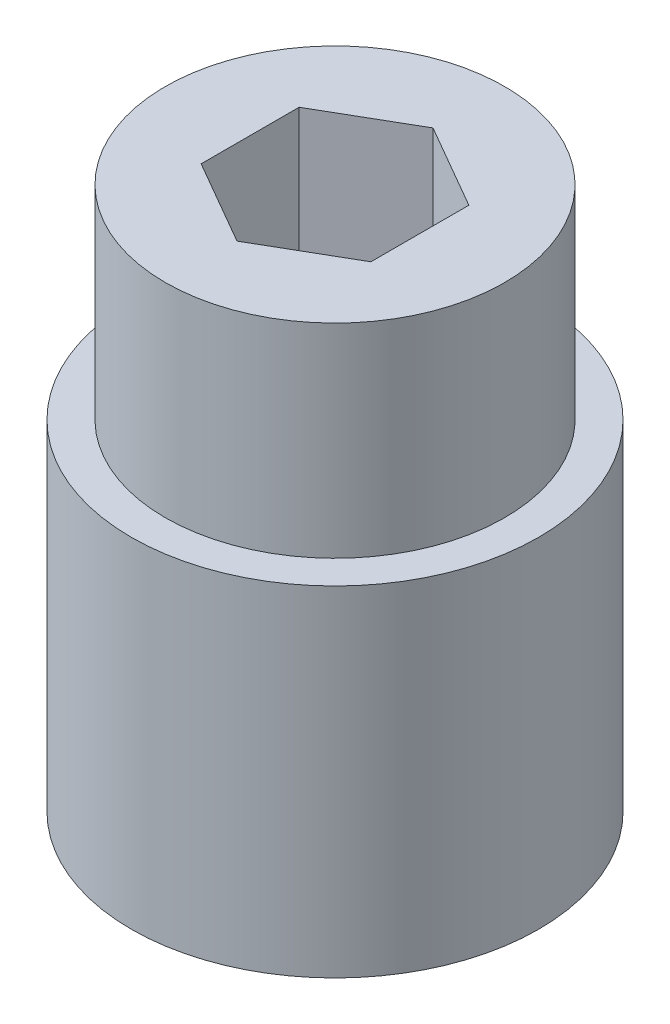
from build123d import *

# Parameters (mm, degrees)
SKETCH1_R           = 7
BOSS_EXTRUDE1_DEPTH = 10
SKETCH2_R           = 5
BOSS_EXTRUDE2_DEPTH = 6
CUT_EXTRUDE2_DEPTH  = 19.814887722
SKETCH5_OUTSIDE_W   = 21.092
SKETCH5_OUTSIDE_H   = 21.092
SKETCH5_OUTSIDE_R   = 6
CUT_EXTRUDE3_DEPTH  = 15.071247279


with BuildPart() as part:
    # Sketch1 → Boss-Extrude1 (new body)
    with BuildSketch(Plane(origin=(0, 0, 0), x_dir=(1, 0, 0), z_dir=(0, 1, 0))):
        with Locations(Location((0, 0, 0), (0, 0, 270))):
            Circle(SKETCH1_R)
    extrude(amount=BOSS_EXTRUDE1_DEPTH)

    # Sketch2 → Boss-Extrude2 (add)
    with BuildSketch(Plane(origin=(0, 10, 0), x_dir=(1, 0, 0), z_dir=(0, 1, 0))):
        with Locations(Location((0, 0, 0), (0, 0, 270))):
            Circle(SKETCH2_R)
    extrude(amount=BOSS_EXTRUDE2_DEPTH)

    # Sketch4 → Cut-Extrude2 (cut, through all)
    with BuildSketch(Plane(origin=(0, 16, 0), x_dir=(1, 0, 0), z_dir=(0, 1, 0))):
        Polygon((2.5, 1.443375673), (0, 2.886751346), (-2.5, 1.443375673), (-2.5, -1.443375673), (0, -2.886751346), (2.5, -1.443375673), align=None)
    extrude(amount=-CUT_EXTRUDE2_DEPTH, mode=Mode.SUBTRACT)

    # Sketch5 outside → Cut-Extrude3 (cut, through all)
    with BuildSketch(Plane(origin=(0, 10, 0), x_dir=(1, 0, 0), z_dir=(0, 1, 0))):
        Rectangle(SKETCH5_OUTSIDE_W, SKETCH5_OUTSIDE_H)
        with Locations(Location((0, 0, 0), (0, 0, 270))):
            Circle(SKETCH5_OUTSIDE_R, mode=Mode.SUBTRACT)
    extrude(amount=-CUT_EXTRUDE3_DEPTH, mode=Mode.SUBTRACT)


solid = part.part
